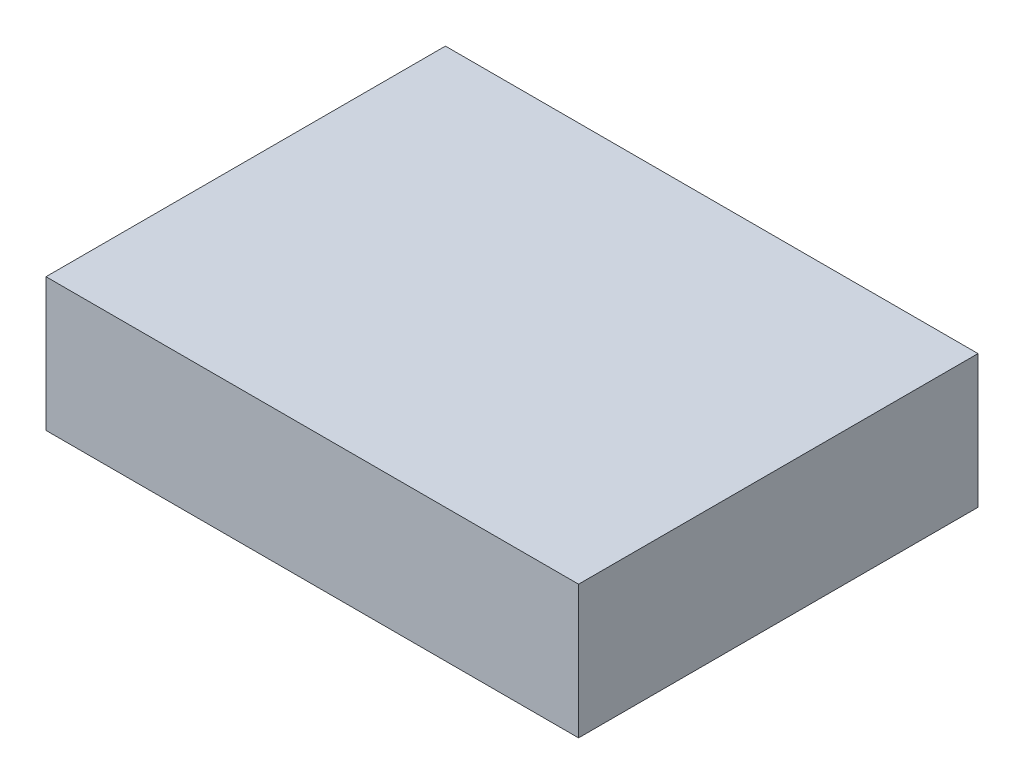
from build123d import *

# Parameters (mm, degrees)
SKETCH1_W           = 50.8
SKETCH1_H           = 38.1
BOSS_EXTRUDE1_DEPTH = 12.7


with BuildPart() as part:
    # Sketch1 → Boss-Extrude1 (new body)
    with BuildSketch(Plane(origin=(0, 0, 0), x_dir=(1, 0, 0), z_dir=(0, 1, 0))):
        with Locations((25.4, 19.05)):
            Rectangle(SKETCH1_W, SKETCH1_H)
    extrude(amount=BOSS_EXTRUDE1_DEPTH)


solid = part.part
